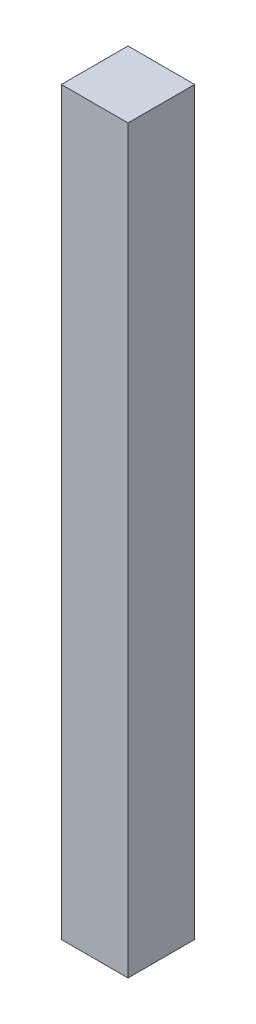
from build123d import *

# Parameters (mm, degrees)
TOPPING_KLAPE_ALT2_GAZLI_AMORTISOR_1_1_START = 8
SKETCH1_W                                    = 18
SKETCH1_H                                    = 200
TOPPING_KLAPE_ALT2_GAZLI_AMORTISOR_1_1_DEPTH = 18


with BuildPart() as part:
    # Sketch1 → TOPPING_klape_alt2_gazli_amortisor_1_1 (new body)
    with BuildSketch(Plane.XY.offset(TOPPING_KLAPE_ALT2_GAZLI_AMORTISOR_1_1_START)):
        with Locations((54, 330)):
            Rectangle(SKETCH1_W, SKETCH1_H)
    extrude(amount=TOPPING_KLAPE_ALT2_GAZLI_AMORTISOR_1_1_DEPTH)


solid = part.part
